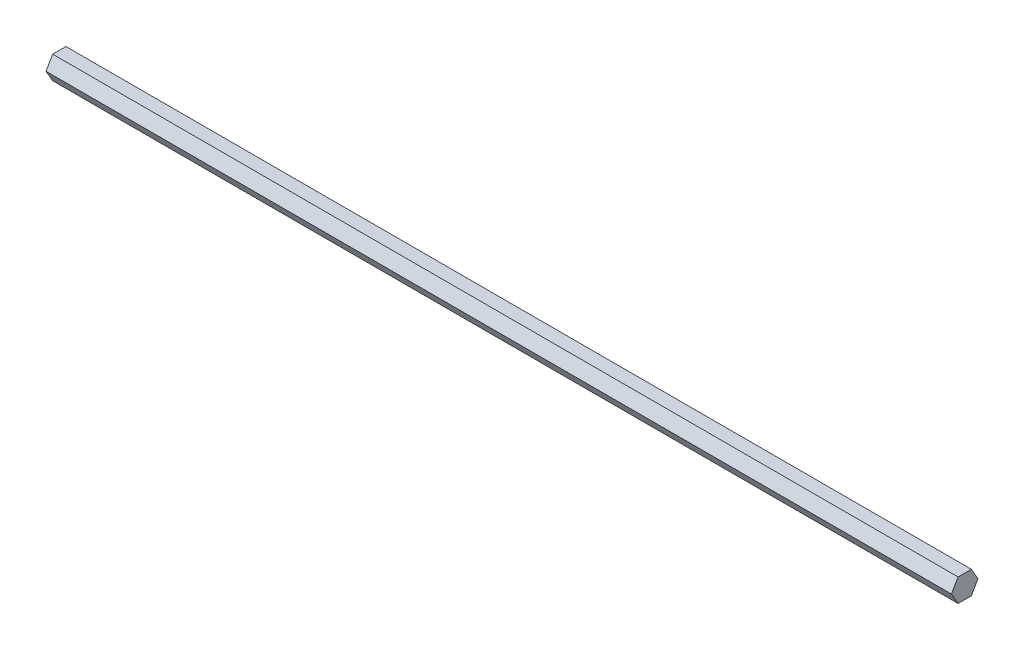
from build123d import *

# Parameters (mm, degrees)
SALIENTE_EXTRUIR1_DEPTH = 500


with BuildPart() as part:
    # Croquis1 → Saliente-Extruir1 (new body)
    with BuildSketch(Plane(origin=(0, 0, 0), x_dir=(0, 0, -1), z_dir=(1, 0, 0))):
        Polygon((7.332348419, 0), (3.666174209, 6.35), (-3.666174209, 6.35), (-7.332348419, 0), (-3.666174209, -6.35), (3.666174209, -6.35), align=None)
    extrude(amount=SALIENTE_EXTRUIR1_DEPTH)


solid = part.part
